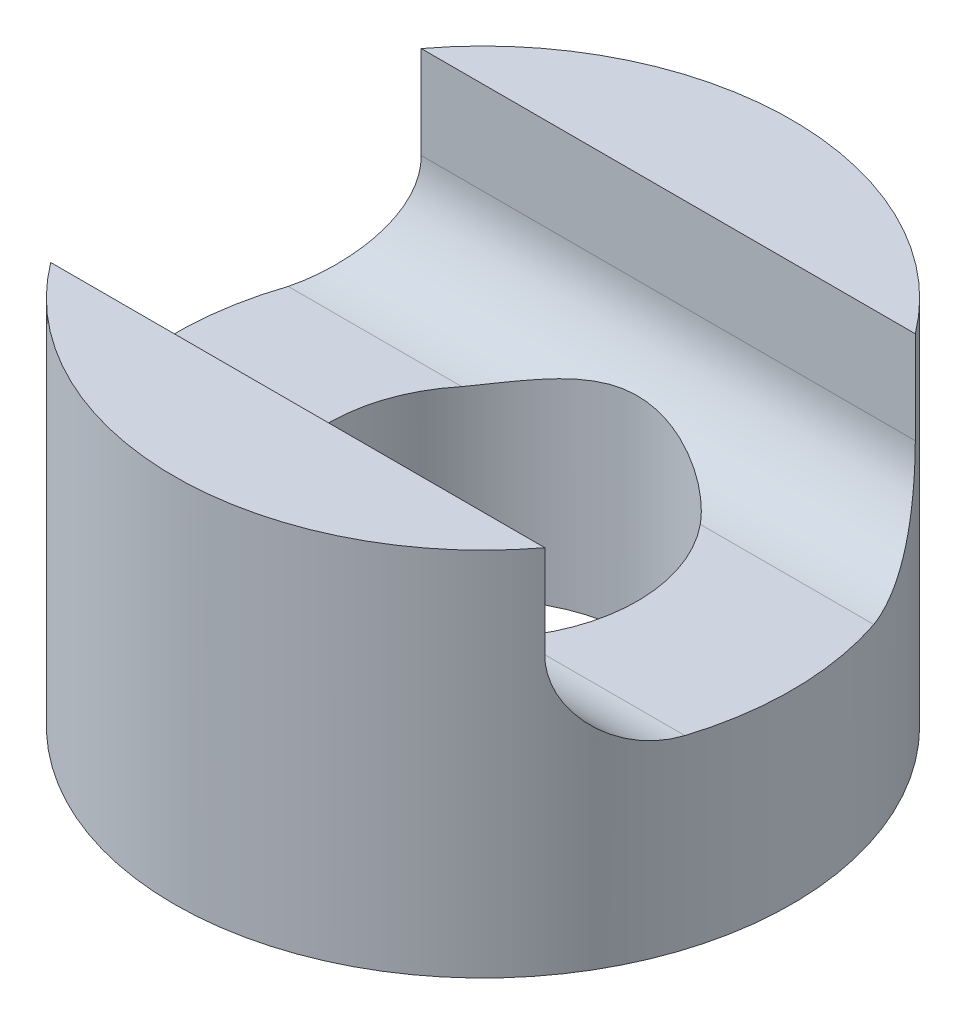
from build123d import *

# Parameters (mm, degrees)
SKETCH1_R               = 7.9375
SKETCH1_R_2             = 3.96875
BOSS_EXTRUDE1_DEPTH     = 9.525
CUT_EXTRUDE1_DEPTH      = 15.721869362
CUT_EXTRUDE1_DEPTH_BACK = 15.721869362


with BuildPart() as part:
    # Sketch1 → Boss-Extrude1 (new body)
    with BuildSketch(Plane(origin=(0, 0, 0), x_dir=(1, 0, 0), z_dir=(0, 1, 0))):
        with Locations(Location((0, 0, 0), (0, 0, 90))):
            Circle(SKETCH1_R)
        with Locations(Location((0, 0, 0), (0, 0, 90))):
            Circle(SKETCH1_R_2, mode=Mode.SUBTRACT)
    extrude(amount=BOSS_EXTRUDE1_DEPTH)

    # Sketch2 → Cut-Extrude1 (cut, two sides: drawn at the far end of the back side and taken through both)
    with BuildSketch(Plane(origin=(0, 0, 0), x_dir=(0, 0, -1), z_dir=(1, 0, 0)).offset(-CUT_EXTRUDE1_DEPTH_BACK)):
        with BuildLine():
            Line((-4.7625, 9.525), (4.7625, 9.525))
            Line((4.7625, 9.525), (4.7625, 7.14375))
            ThreePointArc((4.7625, 7.14375), (4.113428058, 5.508074192), (2.519424024, 4.7625))
            Line((2.519424024, 4.7625), (-2.38125, 4.7625))
            ThreePointArc((-2.38125, 4.7625), (-4.065048023, 5.459951977), (-4.7625, 7.14375))
            Line((-4.7625, 7.14375), (-4.7625, 9.525))
        make_face()
    extrude(amount=CUT_EXTRUDE1_DEPTH + CUT_EXTRUDE1_DEPTH_BACK, mode=Mode.SUBTRACT)


solid = part.part
